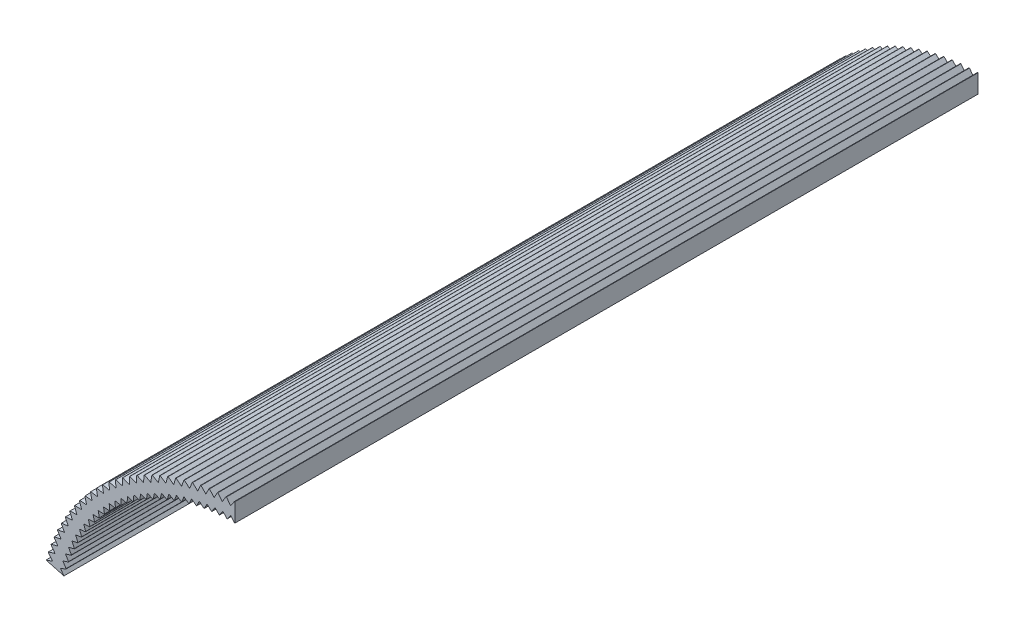
from build123d import *

# Parameters (mm, degrees)
BOSS_EXTRUDE1_DEPTH = 300
CUT_EXTRUDE1_DEPTH  = 305
CIRPATTERN1_COUNT   = 31
CIRPATTERN1_ANGLE   = 75


with BuildPart() as part:
    # Sketch1 → Boss-Extrude1 (new, symmetric)
    with BuildSketch(Plane.XY):
        with BuildLine():
            Line((0, 143), (0, 158))
            ThreePointArc((0, 158), (-96.184305783, 125.349827766), (-152.616280554, 40.893409126))
            Line((-152.616280554, 40.893409126), (-138.127393159, 37.01112345))
            ThreePointArc((-138.127393159, 37.01112345), (-87.052884348, 113.449527662), (0, 143))
        make_face()
    extrude(amount=BOSS_EXTRUDE1_DEPTH, both=True)

    # Sketch2 → Cut-Extrude1 (cut, symmetric)
    with BuildSketch(Plane.XY):
        with BuildLine():
            Line((-151.742438961, 44.025358809), (-147.294975436, 42.735006692))
            Line((-147.294975436, 42.735006692), (-150.804331685, 47.138662953))
            ThreePointArc((-150.804331685, 47.138662953), (-151.281394338, 45.584424174), (-151.742438961, 44.025358809))
        make_face()
        with BuildLine():
            ThreePointArc((-151.742438961, 44.025358809), (-152.187416738, 42.461631936), (-152.616280554, 40.893409126))
            Line((-152.616280554, 40.893409126), (-147.294975436, 42.735006692))
            Line((-147.294975436, 42.735006692), (-151.742438961, 44.025358809))
        make_face()
        with BuildLine():
            Line((-140.947531287, 40.893409126), (-138.127393159, 37.01112345))
            ThreePointArc((-138.127393159, 37.01112345), (-137.739244263, 38.430464348), (-137.336511211, 39.845736138))
            Line((-137.336511211, 39.845736138), (-140.947531287, 40.893409126))
        make_face()
        with BuildLine():
            Line((-136.487464753, 42.663473432), (-140.947531287, 40.893409126))
            Line((-140.947531287, 40.893409126), (-137.336511211, 39.845736138))
            ThreePointArc((-137.336511211, 39.845736138), (-136.919236647, 41.256788968), (-136.487464753, 42.663473432))
        make_face()
    cut_extrude1 = extrude(amount=CUT_EXTRUDE1_DEPTH, both=True, mode=Mode.SUBTRACT)

    # CirPattern1: Cut-Extrude1 ×31 about axis
    cirpattern1_axis = Axis((0, 0, 0), (0, 0, -1))
    for i in range(1, CIRPATTERN1_COUNT):
        add(cut_extrude1.rotate(cirpattern1_axis, i * CIRPATTERN1_ANGLE / (CIRPATTERN1_COUNT - 1)), mode=Mode.SUBTRACT)


solid = part.part
